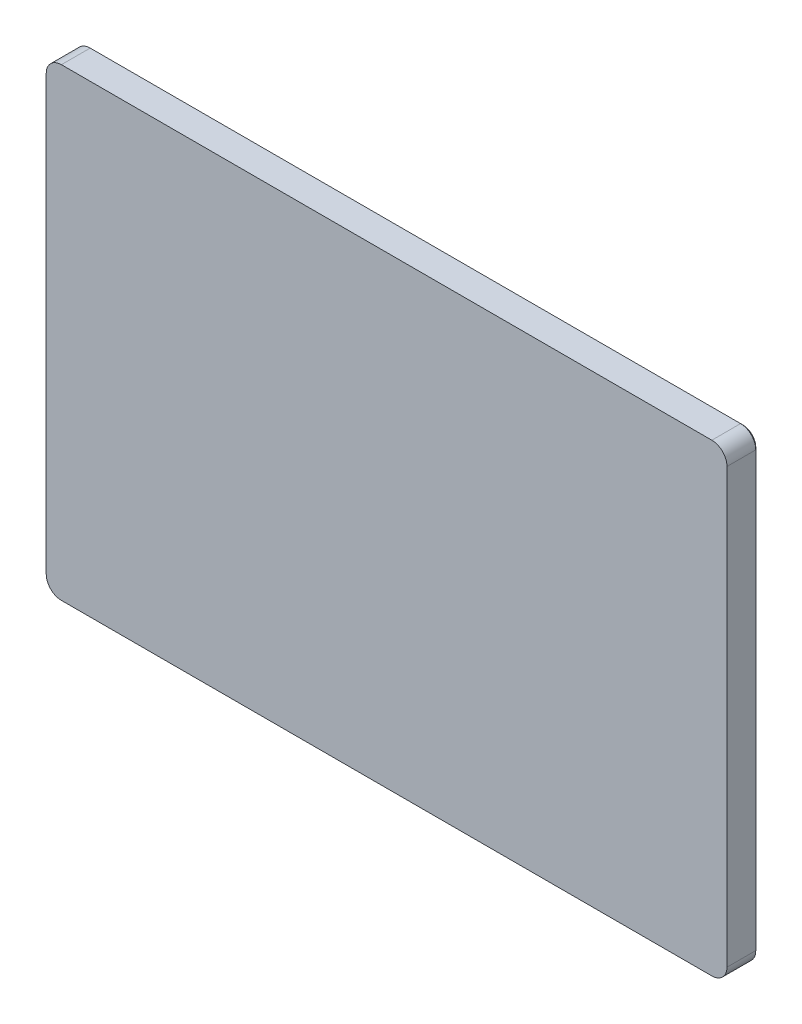
from build123d import *

# Parameters (mm, degrees)
BOSS_EXTRUDE1_DEPTH = 7.9
CHAMFER1_SIZE       = 0.6


with BuildPart() as part:
    # Sketch1 → Boss-Extrude1 (new body)
    with BuildSketch(Plane.XY):
        with BuildLine():
            Line((-82.5, 58.85), (82.5, 58.85))
            ThreePointArc((82.5, 58.85), (85.222361108, 57.722361108), (86.35, 55))
            Line((86.35, 55), (86.35, -55))
            ThreePointArc((86.35, -55), (85.222361108, -57.722361108), (82.5, -58.85))
            Line((82.5, -58.85), (-82.5, -58.85))
            ThreePointArc((-82.5, -58.85), (-85.222361108, -57.722361108), (-86.35, -55))
            Line((-86.35, -55), (-86.35, 55))
            ThreePointArc((-86.35, 55), (-85.222361108, 57.722361108), (-82.5, 58.85))
        make_face()
    extrude(amount=BOSS_EXTRUDE1_DEPTH)

    # Chamfer1
    chamfer1_edges = [part.edges().sort_by_distance(p)[0] for p in [
        (-86.35, 0, 0),
        (-85.222361108, -57.722361108, 0),
        (0, -58.85, 0),
        (85.222361108, -57.722361108, 0),
        (86.35, 0, 0),
        (85.222361108, 57.722361108, 0),
        (0, 58.85, 0),
        (-85.222361108, 57.722361108, 0),
    ]]
    chamfer(chamfer1_edges, length=CHAMFER1_SIZE)


solid = part.part
